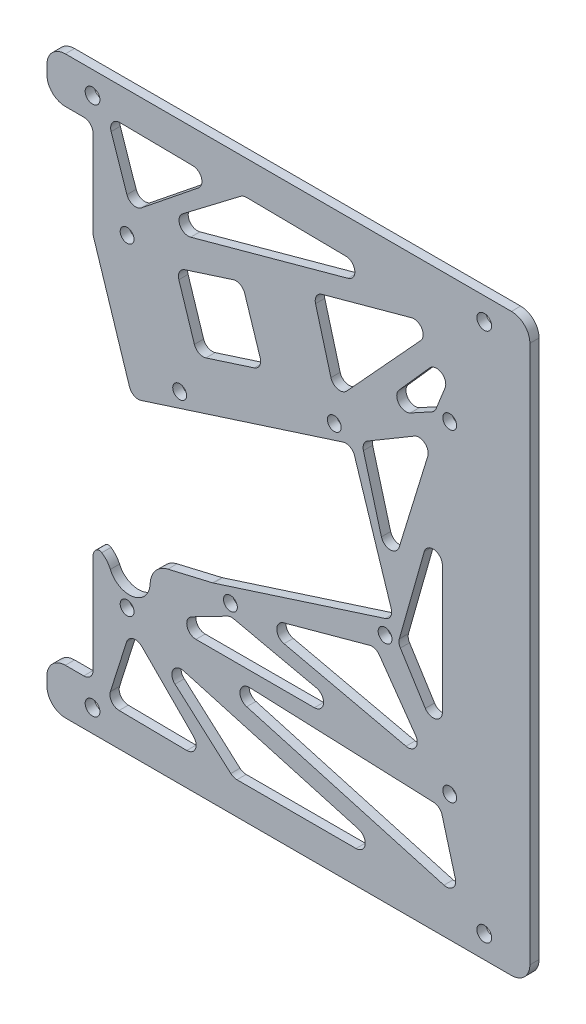
from build123d import *

# Parameters (mm, degrees)
SKETCH_1_R      = 1.6
SKETCH_1_R_2    = 1.5
EXTRUDE_1_DEPTH = 2


with BuildPart() as part:
    # 草图1 → 凸台-拉伸1 (new body)
    with BuildSketch(Plane.XY):
        with BuildLine():
            Line((-44.4, -52.5), (-48.4, -52.5))
            ThreePointArc((-48.4, -52.5), (-51.228427125, -53.671572875), (-52.4, -56.5))
            Line((-52.4, -56.5), (-52.4, -58.4))
            ThreePointArc((-52.4, -58.4), (-51.228427125, -61.228427125), (-48.4, -62.4))
            Line((-48.4, -62.4), (48.4, -62.4))
            ThreePointArc((48.4, -62.4), (51.228427125, -61.228427125), (52.4, -58.4))
            Line((52.4, -58.4), (52.4, 58.4))
            ThreePointArc((52.4, 58.4), (51.228427125, 61.228427125), (48.4, 62.4))
            Line((48.4, 62.4), (-48.4, 62.4))
            ThreePointArc((-48.4, 62.4), (-51.228427125, 61.228427125), (-52.4, 58.4))
            Line((-52.4, 58.4), (-52.4, 56.5))
            ThreePointArc((-52.4, 56.5), (-51.228427125, 53.671572875), (-48.4, 52.5))
            Line((-48.4, 52.5), (-44.4, 52.5))
            ThreePointArc((-44.4, 52.5), (-42.985786438, 51.914213562), (-42.4, 50.5))
            Line((-42.4, 50.5), (-42.4, 31.743164199))
            ThreePointArc((-42.4, 31.743164199), (-42.37587505, 31.433458229), (-42.304082212, 31.1312239))
            Line((-42.304082212, 31.1312239), (-34.476756551, 6.776116715))
            ThreePointArc((-34.476756551, 6.776116715), (-33.486356648, 5.608960434), (-31.96073404, 5.483974801))
            Line((-31.96073404, 5.483974801), (11.833156842, 19.558601667))
            ThreePointArc((11.833156842, 19.558601667), (13.35877945, 19.433616033), (14.349179353, 18.266459753))
            Line((14.349179353, 18.266459753), (22.304403233, -6.486609007))
            ThreePointArc((22.304403233, -6.486609007), (22.1794176, -8.012231615), (21.01226132, -9.002631517))
            Line((21.01226132, -9.002631517), (-16.278628995, -20.987302349))
            ThreePointArc((-16.278628995, -20.987302349), (-16.355786059, -21.010396022), (-16.433810344, -21.030364524))
            Line((-16.433810344, -21.030364524), (-26.148012146, -23.309111102))
            ThreePointArc((-26.148012146, -23.309111102), (-28.868282326, -25.00149387), (-30.002896471, -27.997604687))
            ThreePointArc((-30.002896471, -27.997604687), (-33.674500198, -32.259809436), (-38.636209823, -29.608677444))
            ThreePointArc((-38.636209823, -29.608677444), (-39.400357242, -28.365879544), (-40.490725679, -27.396568153))
            ThreePointArc((-40.490725679, -27.396568153), (-41.09539832, -27.234472424), (-41.677960491, -27.463656512))
            ThreePointArc((-41.677960491, -27.463656512), (-42.210513875, -28.15237372), (-42.4, -29.0021028))
            Line((-42.4, -29.0021028), (-42.4, -50.5))
            ThreePointArc((-42.4, -50.5), (-42.985786438, -51.914213562), (-44.4, -52.5))
        make_face()
        with Locations((-42.5, 57.5)):
            Circle(SKETCH_1_R, mode=Mode.SUBTRACT)
        with Locations((-23.596243703, 11.323307075)):
            Circle(SKETCH_1_R_2, mode=Mode.SUBTRACT)
        with Locations((-35, 35)):
            Circle(SKETCH_1_R_2, mode=Mode.SUBTRACT)
        with Locations((35, 35)):
            Circle(SKETCH_1_R_2, mode=Mode.SUBTRACT)
        with Locations((42.5, 57.5)):
            Circle(SKETCH_1_R, mode=Mode.SUBTRACT)
        with Locations((-42.5, -57.5)):
            Circle(SKETCH_1_R, mode=Mode.SUBTRACT)
        with Locations((42.5, -57.5)):
            Circle(SKETCH_1_R, mode=Mode.SUBTRACT)
        with Locations((35, -35)):
            Circle(SKETCH_1_R_2, mode=Mode.SUBTRACT)
        with Locations((-35, -35)):
            Circle(SKETCH_1_R_2, mode=Mode.SUBTRACT)
        with Locations((-12.58131833, -22.950172746)):
            Circle(SKETCH_1_R_2, mode=Mode.SUBTRACT)
        with Locations((20.978130661, -12.164724985)):
            Circle(SKETCH_1_R_2, mode=Mode.SUBTRACT)
        with Locations((9.963205288, 22.108754836)):
            Circle(SKETCH_1_R_2, mode=Mode.SUBTRACT)
        with BuildLine():
            Line((36.228402422, -50.292195812), (33.346068176, -39.754137802))
            ThreePointArc((33.346068176, -39.754137802), (32.661663143, -38.71633993), (31.496343748, -38.283367205))
            Line((31.496343748, -38.283367205), (-8.428369276, -36.696782686))
            ThreePointArc((-8.428369276, -36.696782686), (-10.482915991, -38.380786509), (-9.052823237, -40.619506186))
            Line((-9.052823237, -40.619506186), (33.754224033, -52.744148714))
            ThreePointArc((33.754224033, -52.744148714), (35.70708051, -52.240427548), (36.228402422, -50.292195812))
        make_face(mode=Mode.SUBTRACT)
        with BuildLine():
            Line((-11.169167715, -55.39772262), (14.676212639, -55.39772262))
            ThreePointArc((14.676212639, -55.39772262), (16.657197457, -53.672857401), (15.221250464, -51.473421768))
            Line((15.221250464, -51.473421768), (-22.734121612, -40.722964827))
            ThreePointArc((-22.734121612, -40.722964827), (-25.033361399, -41.686653646), (-24.606922294, -44.142941378))
            Line((-24.606922294, -44.142941378), (-12.496930572, -54.893398319))
            ThreePointArc((-12.496930572, -54.893398319), (-11.879325656, -55.267395238), (-11.169167715, -55.39772262))
        make_face(mode=Mode.SUBTRACT)
        with BuildLine():
            Line((-36.742590149, -55.165200028), (-22.049714315, -55.339653699))
            ThreePointArc((-22.049714315, -55.339653699), (-20.183876505, -54.118700422), (-20.607795776, -51.929552166))
            Line((-20.607795776, -51.929552166), (-31.792186791, -40.682261625))
            ThreePointArc((-31.792186791, -40.682261625), (-33.681632949, -40.148821509), (-35.116941327, -41.488394201))
            Line((-35.116941327, -41.488394201), (-38.625426146, -52.561231071))
            ThreePointArc((-38.625426146, -52.561231071), (-38.339555845, -54.337218436), (-36.742590149, -55.165200028))
        make_face(mode=Mode.SUBTRACT)
        with BuildLine():
            Line((-13.225378494, -25.687031503), (-20.97493997, -29.683652555))
            ThreePointArc((-20.97493997, -29.683652555), (-22.001813607, -31.932849454), (-20.05822519, -33.461188493))
            Line((-20.05822519, -33.461188493), (5.640197545, -33.461188493))
            ThreePointArc((5.640197545, -33.461188493), (7.628209121, -31.679843412), (6.074886055, -29.508998467))
            Line((6.074886055, -29.508998467), (-11.873975203, -25.512377414))
            ThreePointArc((-11.873975203, -25.512377414), (-12.565009854, -25.481063809), (-13.225378494, -25.687031503))
        make_face(mode=Mode.SUBTRACT)
        with BuildLine():
            Line((17.588533005, -15.747781939), (-1.043142169, -20.843855178))
            ThreePointArc((-1.043142169, -20.843855178), (-2.515026651, -22.816049848), (-0.959614951, -24.723060647))
            Line((-0.959614951, -24.723060647), (25.514222239, -30.752443796))
            ThreePointArc((25.514222239, -30.752443796), (27.619822805, -29.915706508), (27.593050924, -27.650101445))
            Line((27.593050924, -27.650101445), (19.750888908, -16.524645057))
            ThreePointArc((19.750888908, -16.524645057), (18.792402475, -15.794708381), (17.588533005, -15.747781939))
        make_face(mode=Mode.SUBTRACT)
        with BuildLine():
            Line((29.477837532, 7.795881804), (24.066416739, -11.309584207))
            ThreePointArc((24.066416739, -11.309584207), (24.010895626, -12.138003378), (24.296577485, -12.917584543))
            Line((24.296577485, -12.917584543), (29.707998278, -21.542258413))
            ThreePointArc((29.707998278, -21.542258413), (31.955184399, -22.401310498), (33.402138384, -20.479295902))
            Line((33.402138384, -20.479295902), (33.402138384, 7.250843979))
            ThreePointArc((33.402138384, 7.250843979), (31.677273166, 9.231828797), (29.477837532, 7.795881804))
        make_face(mode=Mode.SUBTRACT)
        with BuildLine():
            Line((24.026121987, 5.86217634), (30.248482278, 26.112145879))
            ThreePointArc((30.248482278, 26.112145879), (29.574516748, 28.270520689), (27.318372256, 28.420931424))
            Line((27.318372256, 28.420931424), (17.195320702, 22.43221936))
            ThreePointArc((17.195320702, 22.43221936), (16.359901321, 21.461624711), (16.284509384, 20.183229009))
            Line((16.284509384, 20.183229009), (20.185200647, 5.921971534))
            ThreePointArc((20.185200647, 5.921971534), (22.083209124, 4.4498659), (24.026121987, 5.86217634))
        make_face(mode=Mode.SUBTRACT)
        with BuildLine():
            Line((26.466941663, 32.346827687), (31.13344693, 34.889103877))
            ThreePointArc((31.13344693, 34.889103877), (31.67231487, 35.317620871), (32.033943195, 35.903479579))
            Line((32.033943195, 35.903479579), (34.005211961, 40.838410083))
            ThreePointArc((34.005211961, 40.838410083), (33.198419308, 43.282203141), (30.652232239, 42.908077088))
            Line((30.652232239, 42.908077088), (24.014458205, 35.430870394))
            ThreePointArc((24.014458205, 35.430870394), (23.944750718, 32.85828808), (26.466941663, 32.346827687))
        make_face(mode=Mode.SUBTRACT)
        with BuildLine():
            Line((12.639411879, 29.541355608), (28.719343057, 47.084579709))
            ThreePointArc((28.719343057, 47.084579709), (28.952178023, 49.477824874), (26.717325897, 50.365107531))
            Line((26.717325897, 50.365107531), (7.292247383, 45.052025274))
            ThreePointArc((7.292247383, 45.052025274), (6.082684716, 44.113886743), (5.89075887, 42.595232661))
            Line((5.89075887, 42.595232661), (9.235906205, 30.365090816))
            ThreePointArc((9.235906205, 30.365090816), (10.694578809, 28.948865324), (12.639411879, 29.541355608))
        make_face(mode=Mode.SUBTRACT)
        with BuildLine():
            Line((-6.119101541, 26.393542701), (-9.484773183, 36.865994869))
            ThreePointArc((-9.484773183, 36.865994869), (-10.475173086, 38.033151149), (-12.000795694, 38.158136783))
            Line((-12.000795694, 38.158136783), (-22.473247861, 34.792465141))
            ThreePointArc((-22.473247861, 34.792465141), (-23.640404142, 33.802065238), (-23.765389775, 32.27644263))
            Line((-23.765389775, 32.27644263), (-20.399718133, 21.803990463))
            ThreePointArc((-20.399718133, 21.803990463), (-19.40931823, 20.636834182), (-17.883695622, 20.511848549))
            Line((-17.883695622, 20.511848549), (-7.411243455, 23.877520191))
            ThreePointArc((-7.411243455, 23.877520191), (-6.244087174, 24.867920093), (-6.119101541, 26.393542701))
        make_face(mode=Mode.SUBTRACT)
        with BuildLine():
            Line((-21.208612958, 41.544719282), (12.954393861, 50.888870206))
            ThreePointArc((12.954393861, 50.888870206), (14.410493094, 53.072433346), (12.450486839, 54.817869808))
            Line((12.450486839, 54.817869808), (-9.100688804, 55.073754479))
            ThreePointArc((-9.100688804, 55.073754479), (-9.752383451, 54.972758068), (-10.335803304, 54.66530488))
            Line((-10.335803304, 54.66530488), (-22.947634479, 45.065269285))
            ThreePointArc((-22.947634479, 45.065269285), (-23.529428542, 42.588103366), (-21.208612958, 41.544719282))
        make_face(mode=Mode.SUBTRACT)
        with BuildLine():
            Line((-38.466382383, 52.758728631), (-35.036841892, 42.623668672))
            ThreePointArc((-35.036841892, 42.623668672), (-33.702415155, 41.344743502), (-31.889657598, 41.705651167))
            Line((-31.889657598, 41.705651167), (-19.509525421, 51.652997335))
            ThreePointArc((-19.509525421, 51.652997335), (-18.871772637, 53.864883905), (-20.738488051, 55.211934154))
            Line((-20.738488051, 55.211934154), (-36.548160719, 55.399647945))
            ThreePointArc((-36.548160719, 55.399647945), (-38.190090809, 54.57515145), (-38.466382383, 52.758728631))
        make_face(mode=Mode.SUBTRACT)
    extrude(amount=EXTRUDE_1_DEPTH)


solid = part.part
